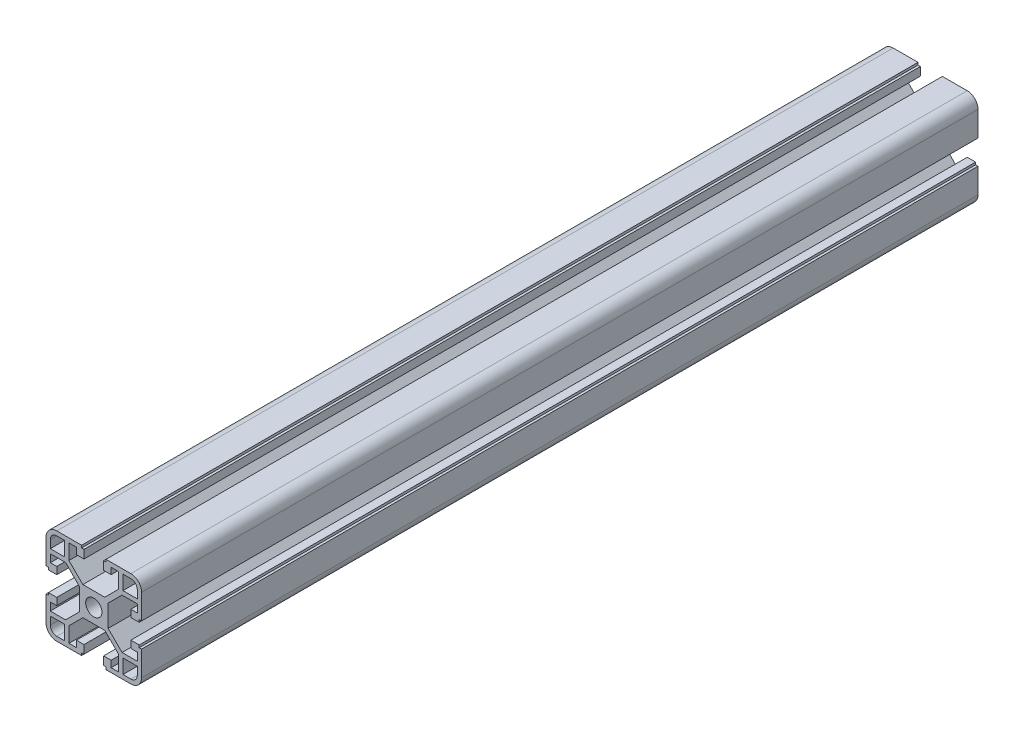
from build123d import *

# Parameters (mm, degrees)
SKETCH3_R           = 3.4
BOSS_EXTRUDE1_DEPTH = 350


with BuildPart() as part:
    # Sketch3 → Boss-Extrude1 (new body)
    with BuildSketch(Plane.XY):
        with BuildLine():
            Line((-11.814213562, 10.4), (-6, 4.585786438))
            Line((-6, 4.585786438), (-6, -4.585786438))
            Line((-6, -4.585786438), (-11.814213562, -10.4))
            Line((-11.814213562, -10.4), (-18.2, -10.4))
            Line((-18.2, -10.4), (-18.2, -7.1))
            Line((-18.2, -7.1), (-15.5, -7.1))
            Line((-15.5, -7.1), (-15.5, -4.1))
            Line((-15.5, -4.1), (-19, -4.1))
            Line((-19, -4.1), (-19, -5.1))
            Line((-19, -5.1), (-20, -5.1))
            Line((-20, -5.1), (-20, -15.5))
            ThreePointArc((-20, -15.5), (-18.681980515, -18.681980515), (-15.5, -20))
            Line((-15.5, -20), (-5.1, -20))
            Line((-5.1, -20), (-5.1, -19))
            Line((-5.1, -19), (-4.1, -19))
            Line((-4.1, -19), (-4.1, -15.5))
            Line((-4.1, -15.5), (-7.258114106, -15.5))
            Line((-7.258114106, -15.5), (-7.258114106, -18.2))
            Line((-7.258114106, -18.2), (-10.4, -18.2))
            Line((-10.4, -18.2), (-10.4, -11.814213562))
            Line((-10.4, -11.814213562), (-4.585786438, -6))
            Line((-4.585786438, -6), (4.585786438, -6))
            Line((4.585786438, -6), (10.4, -11.814213562))
            Line((10.4, -11.814213562), (10.4, -18.2))
            Line((10.4, -18.2), (7.258114106, -18.2))
            Line((7.258114106, -18.2), (7.258114106, -15.5))
            Line((7.258114106, -15.5), (4.1, -15.5))
            Line((4.1, -15.5), (4.1, -19))
            Line((4.1, -19), (5.1, -19))
            Line((5.1, -19), (5.1, -20))
            Line((5.1, -20), (15.5, -20))
            ThreePointArc((15.5, -20), (18.681980515, -18.681980515), (20, -15.5))
            Line((20, -15.5), (20, -5.1))
            Line((20, -5.1), (19, -5.1))
            Line((19, -5.1), (19, -4.1))
            Line((19, -4.1), (15.5, -4.1))
            Line((15.5, -4.1), (15.5, -7.1))
            Line((15.5, -7.1), (18.2, -7.1))
            Line((18.2, -7.1), (18.2, -10.4))
            Line((18.2, -10.4), (11.814213562, -10.4))
            Line((11.814213562, -10.4), (6, -4.585786438))
            Line((6, -4.585786438), (6, 4.585786438))
            Line((6, 4.585786438), (11.814213562, 10.4))
            Line((11.814213562, 10.4), (18.2, 10.4))
            Line((18.2, 10.4), (18.2, 7.1))
            Line((18.2, 7.1), (15.5, 7.1))
            Line((15.5, 7.1), (15.5, 4.1))
            Line((15.5, 4.1), (19, 4.1))
            Line((19, 4.1), (19, 5.1))
            Line((19, 5.1), (20, 5.1))
            Line((20, 5.1), (20, 15.5))
            ThreePointArc((20, 15.5), (18.681980515, 18.681980515), (15.5, 20))
            Line((15.5, 20), (5.1, 20))
            Line((5.1, 20), (5.1, 19))
            Line((5.1, 19), (4.1, 19))
            Line((4.1, 19), (4.1, 15.5))
            Line((4.1, 15.5), (7.258114106, 15.5))
            Line((7.258114106, 15.5), (7.258114106, 18.2))
            Line((7.258114106, 18.2), (10.4, 18.2))
            Line((10.4, 18.2), (10.4, 11.814213562))
            Line((10.4, 11.814213562), (4.585786438, 6))
            Line((4.585786438, 6), (-4.585786438, 6))
            Line((-4.585786438, 6), (-10.4, 11.814213562))
            Line((-10.4, 11.814213562), (-10.4, 18.2))
            Line((-10.4, 18.2), (-7.258114106, 18.2))
            Line((-7.258114106, 18.2), (-7.258114106, 15.5))
            Line((-7.258114106, 15.5), (-4.1, 15.5))
            Line((-4.1, 15.5), (-4.1, 19))
            Line((-4.1, 19), (-5.1, 19))
            Line((-5.1, 19), (-5.1, 20))
            Line((-5.1, 20), (-15.5, 20))
            ThreePointArc((-15.5, 20), (-18.681980515, 18.681980515), (-20, 15.5))
            Line((-20, 15.5), (-20, 5.1))
            Line((-20, 5.1), (-19, 5.1))
            Line((-19, 5.1), (-19, 4.1))
            Line((-19, 4.1), (-15.5, 4.1))
            Line((-15.5, 4.1), (-15.5, 7.1))
            Line((-15.5, 7.1), (-18.2, 7.1))
            Line((-18.2, 7.1), (-18.2, 10.4))
            Line((-18.2, 10.4), (-11.814213562, 10.4))
        make_face()
        with BuildLine():
            Line((-18.2, -15.5), (-18.2, -12.2))
            Line((-18.2, -12.2), (-12.2, -12.2))
            Line((-12.2, -12.2), (-12.2, -18.2))
            Line((-12.2, -18.2), (-15.5, -18.2))
            ThreePointArc((-15.5, -18.2), (-17.409188309, -17.409188309), (-18.2, -15.5))
        make_face(mode=Mode.SUBTRACT)
        Circle(SKETCH3_R, mode=Mode.SUBTRACT)
        with BuildLine():
            Line((-18.2, 12.2), (-18.2, 15.5))
            ThreePointArc((-18.2, 15.5), (-17.409188309, 17.409188309), (-15.5, 18.2))
            Line((-15.5, 18.2), (-12.2, 18.2))
            Line((-12.2, 18.2), (-12.2, 12.2))
            Line((-12.2, 12.2), (-18.2, 12.2))
        make_face(mode=Mode.SUBTRACT)
        with BuildLine():
            Line((18.2, 15.5), (18.2, 12.2))
            Line((18.2, 12.2), (12.2, 12.2))
            Line((12.2, 12.2), (12.2, 18.2))
            Line((12.2, 18.2), (15.5, 18.2))
            ThreePointArc((15.5, 18.2), (17.409188309, 17.409188309), (18.2, 15.5))
        make_face(mode=Mode.SUBTRACT)
        with BuildLine():
            Line((12.2, -18.2), (12.2, -12.2))
            Line((12.2, -12.2), (18.2, -12.2))
            Line((18.2, -12.2), (18.2, -15.5))
            ThreePointArc((18.2, -15.5), (17.409188309, -17.409188309), (15.5, -18.2))
            Line((15.5, -18.2), (12.2, -18.2))
        make_face(mode=Mode.SUBTRACT)
    extrude(amount=BOSS_EXTRUDE1_DEPTH)


solid = part.part
